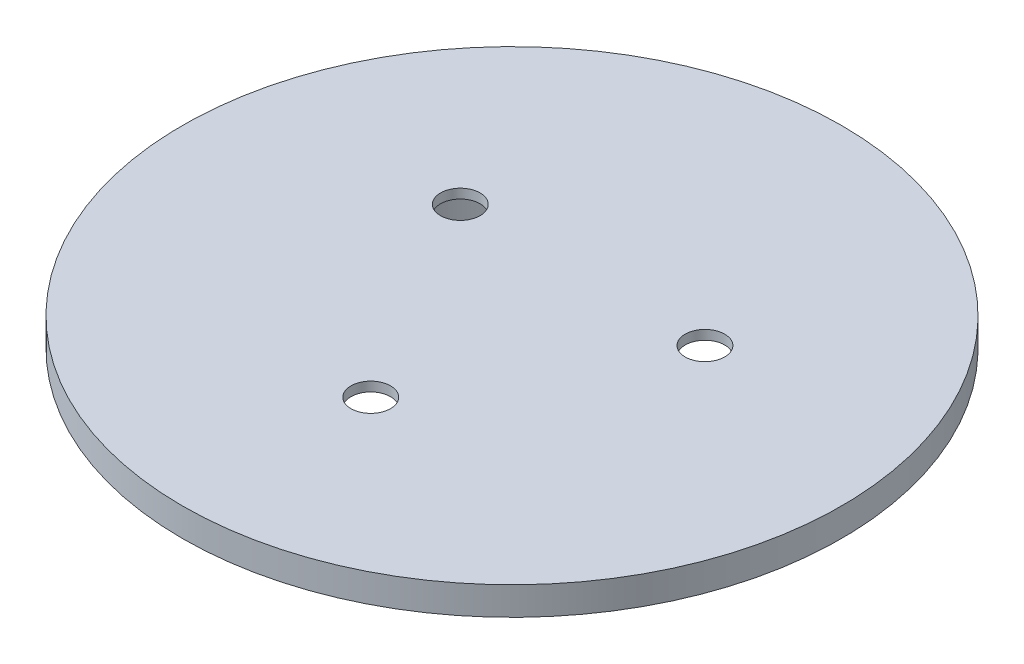
from build123d import *

# Parameters (mm, degrees)
SKETCH1_R           = 25
BOSS_EXTRUDE1_DEPTH = 4
SKETCH2_R           = 35
BOSS_EXTRUDE2_DEPTH = 3
SKETCH3_R           = 20.05
CUT_EXTRUDE1_DEPTH  = 6
CUT_EXTRUDE2_REACH  = 51.86
SKETCH4_R           = 2.1


with BuildPart() as part:
    # Sketch1 → Boss-Extrude1 (new body)
    with BuildSketch(Plane(origin=(0, 0, 0), x_dir=(1, 0, 0), z_dir=(0, 1, 0))):
        with Locations(Location((0, 0, 0), (0, 0, 270))):
            Circle(SKETCH1_R)
    extrude(amount=BOSS_EXTRUDE1_DEPTH)

    # Sketch2 → Boss-Extrude2 (add)
    with BuildSketch(Plane(origin=(0, 4, 0), x_dir=(1, 0, 0), z_dir=(0, 1, 0))):
        with Locations(Location((0, 0, 0), (0, 0, 270))):
            Circle(SKETCH2_R)
    extrude(amount=BOSS_EXTRUDE2_DEPTH)

    # Sketch3 → Cut-Extrude1 (cut)
    with BuildSketch(Plane.XZ):
        with Locations(Location((0, 0, 0), (0, 0, 270))):
            Circle(SKETCH3_R)
    extrude(amount=-CUT_EXTRUDE1_DEPTH, mode=Mode.SUBTRACT)

    # Sketch4 → Cut-Extrude2 (cut, up to next)
    with BuildSketch(Plane.XZ.offset(-6), mode=Mode.PRIVATE) as cut_extrude2_sk1:
        with Locations(Location((0, 15, 0), (0, 0, 270))):
            Circle(SKETCH4_R)
    cut_extrude2_tool1 = extrude(cut_extrude2_sk1.sketch, amount=-CUT_EXTRUDE2_REACH, mode=Mode.PRIVATE) & part.part
    # Sketch4 → Cut-Extrude2 (cut, up to next)
    with BuildSketch(Plane.XZ.offset(-6), mode=Mode.PRIVATE) as cut_extrude2_sk2:
        with Locations(Location((-12.990381057, -7.5, 0), (0, 0, 270))):
            Circle(SKETCH4_R)
    cut_extrude2_tool2 = extrude(cut_extrude2_sk2.sketch, amount=-CUT_EXTRUDE2_REACH, mode=Mode.PRIVATE) & part.part
    # Sketch4 → Cut-Extrude2 (cut, up to next)
    with BuildSketch(Plane.XZ.offset(-6), mode=Mode.PRIVATE) as cut_extrude2_sk3:
        with Locations(Location((12.990381057, -7.5, 0), (0, 0, 270))):
            Circle(SKETCH4_R)
    cut_extrude2_tool3 = extrude(cut_extrude2_sk3.sketch, amount=-CUT_EXTRUDE2_REACH, mode=Mode.PRIVATE) & part.part
    add(cut_extrude2_tool1.solids().sort_by_distance((0, 6, 15))[0], mode=Mode.SUBTRACT)
    add(cut_extrude2_tool2.solids().sort_by_distance((-12.990381, 6, -7.5))[0], mode=Mode.SUBTRACT)
    add(cut_extrude2_tool3.solids().sort_by_distance((12.990381, 6, -7.5))[0], mode=Mode.SUBTRACT)


solid = part.part
